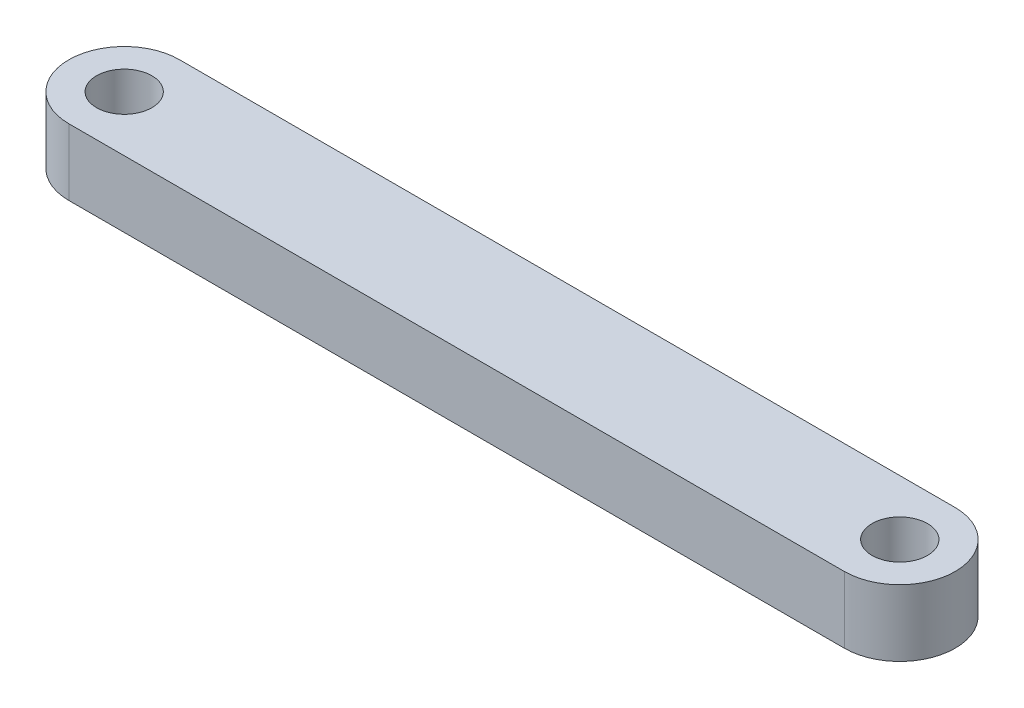
from build123d import *

# Parameters (mm, degrees)
SKETCH1_R           = 1.25
BOSS_EXTRUDE1_DEPTH = 3


with BuildPart() as part:
    # Sketch1 → Boss-Extrude1 (new body)
    with BuildSketch(Plane(origin=(0, 0, 0), x_dir=(1, 0, 0), z_dir=(0, 1, 0))):
        with BuildLine():
            Line((0, 2.5), (35, 2.5))
            ThreePointArc((35, 2.5), (37.5, 0), (35, -2.5))
            Line((35, -2.5), (0, -2.5))
            ThreePointArc((0, -2.5), (-2.5, 0), (0, 2.5))
        make_face()
        with Locations(Location((0, 0, 0), (0, 0, 270))):
            Circle(SKETCH1_R, mode=Mode.SUBTRACT)
        with Locations(Location((35, 0, 0), (0, 0, 270))):
            Circle(SKETCH1_R, mode=Mode.SUBTRACT)
    extrude(amount=BOSS_EXTRUDE1_DEPTH)


solid = part.part
